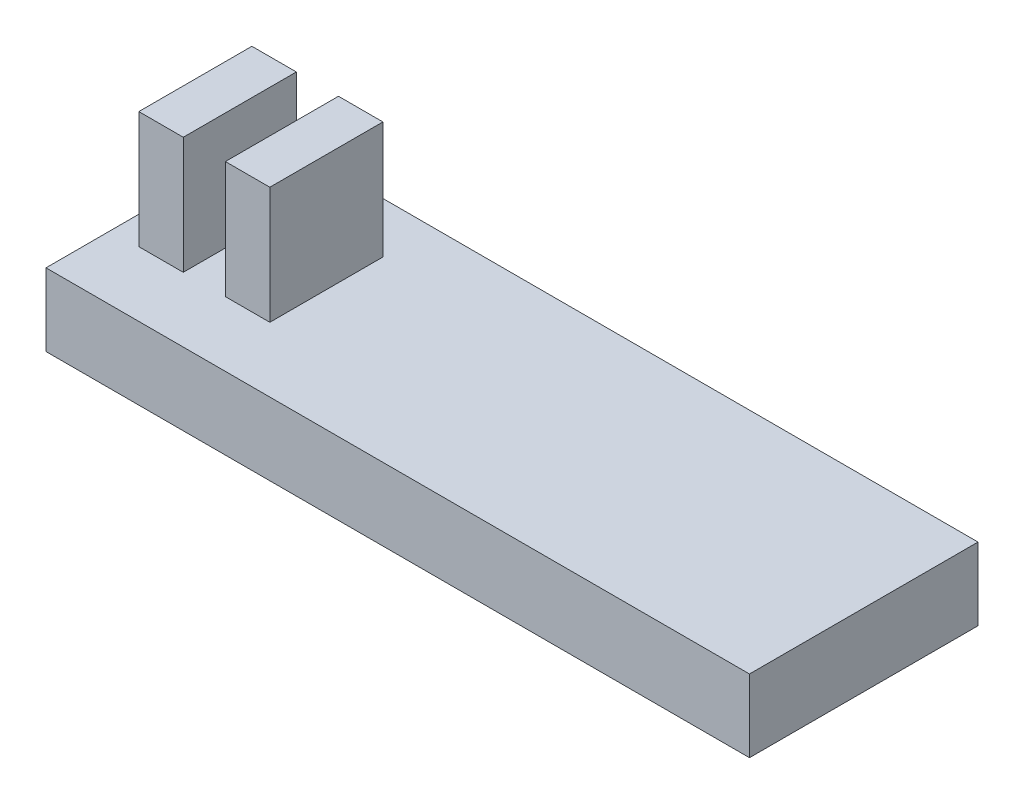
from build123d import *

# Parameters (mm, degrees)
SKETCH1_W           = 90.2
SKETCH1_H           = 29.3
BOSS_EXTRUDE1_DEPTH = 9.3
SKETCH2_W           = 5.7
SKETCH2_H           = 14.5
BOSS_EXTRUDE2_DEPTH = 15


with BuildPart() as part:
    # Sketch1 → Boss-Extrude1 (new body)
    with BuildSketch(Plane(origin=(0, 0, 0), x_dir=(1, 0, 0), z_dir=(0, 1, 0))):
        Rectangle(SKETCH1_W, SKETCH1_H)
    extrude(amount=BOSS_EXTRUDE1_DEPTH)

    # Sketch2 → Boss-Extrude2 (add)
    with BuildSketch(Plane(origin=(0, 9.3, 0), x_dir=(1, 0, 0), z_dir=(0, 1, 0))):
        with Locations((-38.65, 0.9)):
            Rectangle(SKETCH2_W, SKETCH2_H)
        with Locations((-27.55, 0.9)):
            Rectangle(SKETCH2_W, SKETCH2_H)
    extrude(amount=BOSS_EXTRUDE2_DEPTH)


solid = part.part
